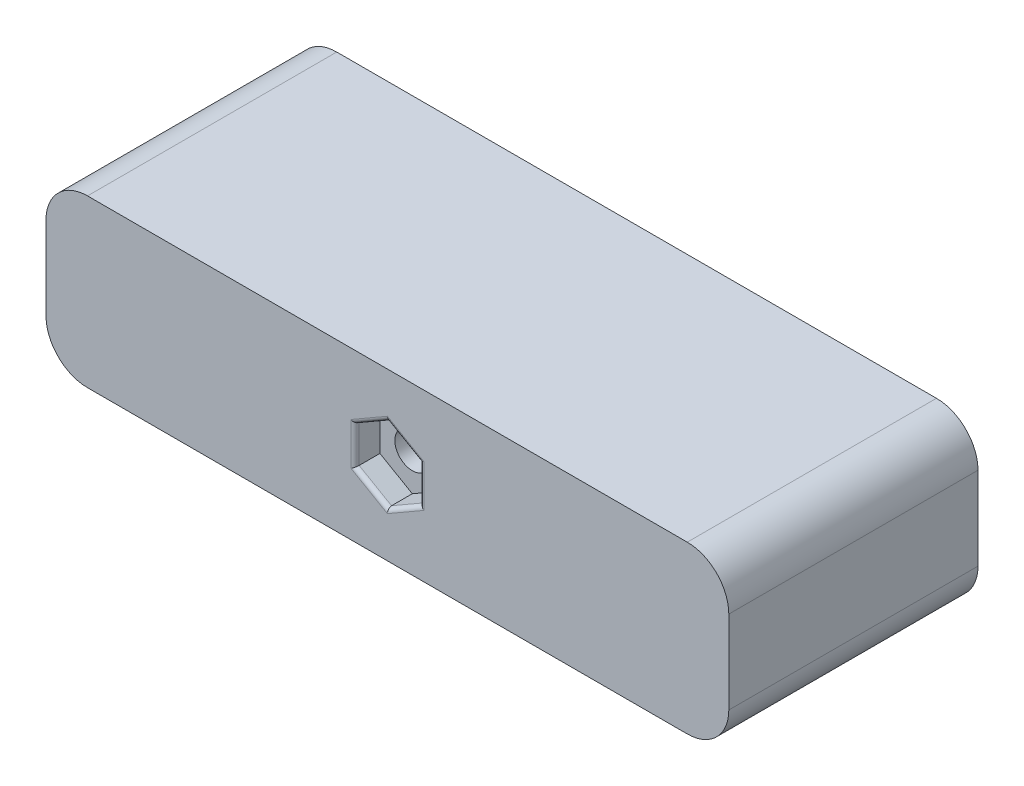
from build123d import *

# Parameters (mm, degrees)
ESQUISSE1_W             = 82.2
ESQUISSE1_H             = 20
BOSS_EXTRU_1_DEPTH      = 30
ENL_V_MAT_EXTRU_1_DEPTH = 3
CONG_1_R                = 5
CONG_2_R                = 0.5
ESQUISSE8_R             = 2.103774153
ENL_V_MAT_EXTRU_3_DEPTH = 90.759901961


with BuildPart() as part:
    # Esquisse1 → Boss.-Extru.1 (new body)
    with BuildSketch(Plane.XY):
        with Locations((-41.1, 10)):
            Rectangle(ESQUISSE1_W, ESQUISSE1_H)
    extrude(amount=BOSS_EXTRU_1_DEPTH)

    # Esquisse2 → Enlèv. mat.-Extru.1 (cut)
    with BuildSketch(Plane.XY.offset(30)):
        Polygon((-41.1, 5.4966679), (-37.2, 7.74833395), (-37.2, 12.25166605), (-41.1, 14.5033321), (-45, 12.25166605), (-45, 7.74833395), align=None)
    extrude(amount=-ENL_V_MAT_EXTRU_1_DEPTH, mode=Mode.SUBTRACT)

    # Congé1
    cong_1_edges = [part.edges().sort_by_distance(p)[0] for p in [
        (0, 0, 15),
        (-82.2, 0, 15),
        (-82.2, 20, 15),
        (0, 20, 15),
    ]]
    fillet(cong_1_edges, radius=CONG_1_R)

    # Congé2
    cong_2_edges = [part.edges().sort_by_distance(p)[0] for p in [
        (-43.05, 6.622500925, 30),
        (-39.15, 6.622500925, 30),
        (-37.2, 10, 30),
        (-39.15, 13.377499075, 30),
        (-43.05, 13.377499075, 30),
        (-45, 10, 30),
    ]]
    fillet(cong_2_edges, radius=CONG_2_R)

    # Esquisse8 → Enlèv. mat.-Extru.3 (cut, through all)
    with BuildSketch(Plane.XY):
        with Locations((-41.1, 10)):
            Circle(ESQUISSE8_R)
    extrude(amount=ENL_V_MAT_EXTRU_3_DEPTH, mode=Mode.SUBTRACT)


solid = part.part
